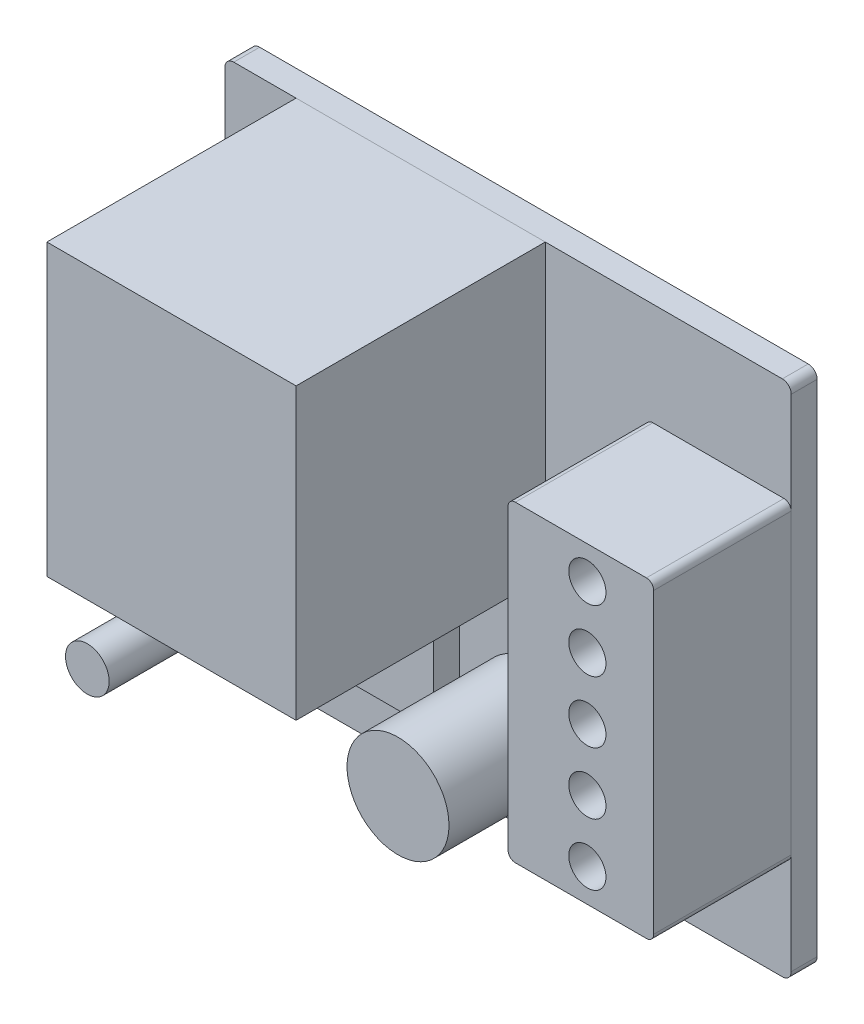
from build123d import *

# Parameters (mm, degrees)
PCB_35X32_DEPTH                   = 1.6
RELAY_24V_START                   = 1.6
RELAY_24V_SKETCH_W                = 15.4
RELAY_24V_SKETCH_H                = 17.9
RELAY_24V_DEPTH                   = 15.4
FIVE_POSITION_3P81_TERMINAL_START = 1.6
FIVE_POSITION_3P81_TERMINAL_DEPTH = 8.5
FIVE_TERMINAL_RECESSES_START      = 8.1
FIVE_TERMINAL_RECESSES_SKETCH_R   = 1.15
FIVE_TERMINAL_RECESSES_DEPTH      = 2
RECEIVER_CAPACITOR_START          = 1.6
RECEIVER_CAPACITOR_SKETCH_R       = 3.15
RECEIVER_CAPACITOR_DEPTH          = 8.2
RF_COIL_ENVELOPE_START            = 1.6
RF_COIL_ENVELOPE_SKETCH_R         = 1.35
RF_COIL_ENVELOPE_DEPTH            = 11
RECEIVER_IC_START                 = 1.6
RECEIVER_IC_SKETCH_W              = 7
RECEIVER_IC_SKETCH_H              = 5.4
RECEIVER_IC_DEPTH                 = 1.6
LEARN_BUTTON_START                = 1.6
LEARN_BUTTON_SKETCH_R             = 1.7
LEARN_BUTTON_DEPTH                = 3.1


with BuildPart() as part:
    # PCB_35x32_Sketch → PCB_35x32 (new body)
    with BuildSketch(Plane.XY):
        with BuildLine():
            Line((-16.95, -16), (16.95, -16))
            ThreePointArc((16.95, -16), (17.33890873, -15.83890873), (17.5, -15.45))
            Line((17.5, -15.45), (17.5, 15.45))
            ThreePointArc((17.5, 15.45), (17.33890873, 15.83890873), (16.95, 16))
            Line((16.95, 16), (-16.95, 16))
            ThreePointArc((-16.95, 16), (-17.33890873, 15.83890873), (-17.5, 15.45))
            Line((-17.5, 15.45), (-17.5, -15.45))
            ThreePointArc((-17.5, -15.45), (-17.33890873, -15.83890873), (-16.95, -16))
        make_face()
    extrude(amount=PCB_35X32_DEPTH)


with BuildPart() as body_2:
    # Relay_24V_Sketch → Relay_24V (new body)
    with BuildSketch(Plane.XY.offset(RELAY_24V_START)):
        with Locations((-5.4, 7.05)):
            Rectangle(RELAY_24V_SKETCH_W, RELAY_24V_SKETCH_H)
    extrude(amount=RELAY_24V_DEPTH)


with BuildPart() as body_3:
    # Five_position_3p81_terminal_Sketch → Five_position_3p81_terminal (new body)
    with BuildSketch(Plane.XY.offset(FIVE_POSITION_3P81_TERMINAL_START)):
        with BuildLine():
            Line((8.95, -9.65), (17.05, -9.65))
            ThreePointArc((17.05, -9.65), (17.368198052, -9.518198052), (17.5, -9.2))
            Line((17.5, -9.2), (17.5, 9.2))
            ThreePointArc((17.5, 9.2), (17.368198052, 9.518198052), (17.05, 9.65))
            Line((17.05, 9.65), (8.95, 9.65))
            ThreePointArc((8.95, 9.65), (8.631801948, 9.518198052), (8.5, 9.2))
            Line((8.5, 9.2), (8.5, -9.2))
            ThreePointArc((8.5, -9.2), (8.631801948, -9.518198052), (8.95, -9.65))
        make_face()
    extrude(amount=FIVE_POSITION_3P81_TERMINAL_DEPTH)

    # Five_terminal_recesses_Sketch → Five_terminal_recesses (cut)
    with BuildSketch(Plane.XY.offset(FIVE_TERMINAL_RECESSES_START)):
        with Locations((13.4, -7.62)):
            Circle(FIVE_TERMINAL_RECESSES_SKETCH_R)
        with Locations((13.4, -3.81)):
            Circle(FIVE_TERMINAL_RECESSES_SKETCH_R)
        with Locations((13.4, 0)):
            Circle(FIVE_TERMINAL_RECESSES_SKETCH_R)
        with Locations((13.4, 3.81)):
            Circle(FIVE_TERMINAL_RECESSES_SKETCH_R)
        with Locations((13.4, 7.62)):
            Circle(FIVE_TERMINAL_RECESSES_SKETCH_R)
    extrude(amount=FIVE_TERMINAL_RECESSES_DEPTH, mode=Mode.SUBTRACT)


with BuildPart() as body_4:
    # Receiver_capacitor_Sketch → Receiver_capacitor (new body)
    with BuildSketch(Plane.XY.offset(RECEIVER_CAPACITOR_START)):
        with Locations((1.4, -10)):
            Circle(RECEIVER_CAPACITOR_SKETCH_R)
    extrude(amount=RECEIVER_CAPACITOR_DEPTH)


with BuildPart() as body_5:
    # RF_coil_envelope_Sketch → RF_coil_envelope (new body)
    with BuildSketch(Plane.XY.offset(RF_COIL_ENVELOPE_START)):
        with Locations((-15, -10)):
            Circle(RF_COIL_ENVELOPE_SKETCH_R)
    extrude(amount=RF_COIL_ENVELOPE_DEPTH)


with BuildPart() as body_6:
    # Receiver_IC_Sketch → Receiver_IC (new body)
    with BuildSketch(Plane.XY.offset(RECEIVER_IC_START)):
        with Locations((-6.5, -9.3)):
            Rectangle(RECEIVER_IC_SKETCH_W, RECEIVER_IC_SKETCH_H)
    extrude(amount=RECEIVER_IC_DEPTH)


with BuildPart() as body_7:
    # Learn_button_Sketch → Learn_button (new body)
    with BuildSketch(Plane.XY.offset(LEARN_BUTTON_START)):
        with Locations((-8, -2.9)):
            Circle(LEARN_BUTTON_SKETCH_R)
    extrude(amount=LEARN_BUTTON_DEPTH)


solid = Compound([part.part, body_2.part, body_3.part, body_4.part, body_5.part, body_6.part, body_7.part])
